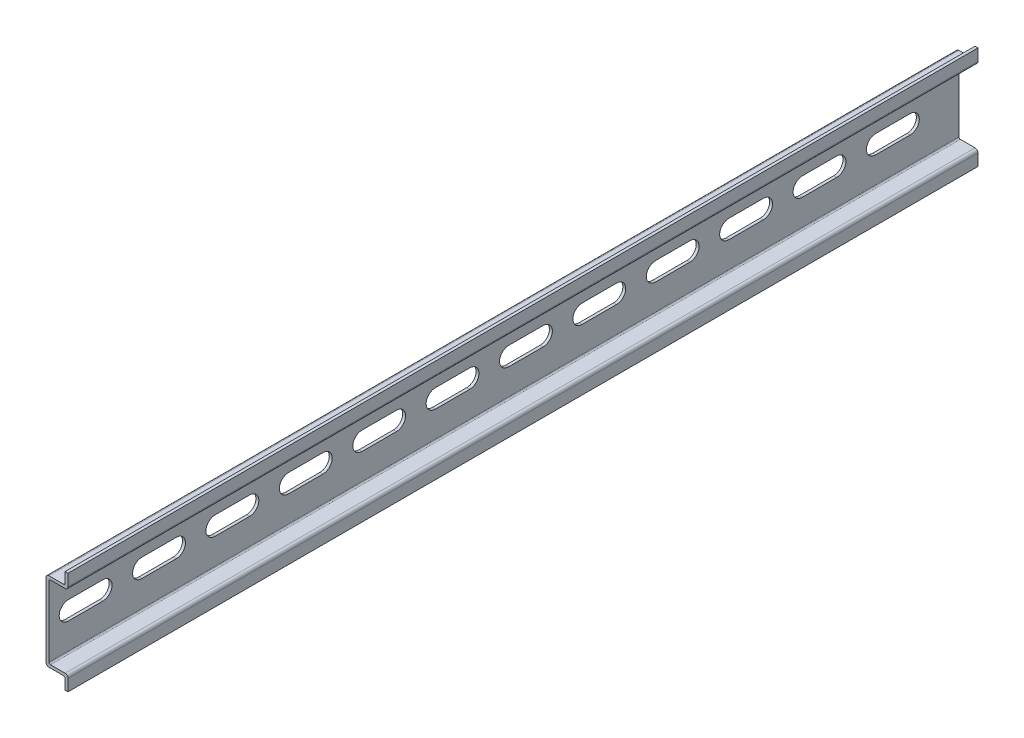
from build123d import *

# Parameters (mm, degrees)
BOSS_EXTRUDE1_DEPTH = 155
CUT_EXTRUDE1_DEPTH  = 7.5
LPATTERN1_COUNT     = 12
LPATTERN1_PITCH     = 25


with BuildPart() as part:
    # Sketch1 → Boss-Extrude1 (new, symmetric)
    with BuildSketch(Plane.XY):
        with BuildLine():
            Line((7.5, 17.5), (6.5, 17.5))
            Line((6.5, 17.5), (6.5, 14))
            ThreePointArc((6.5, 14), (6.353553391, 13.646446609), (6, 13.5))
            Line((6, 13.5), (1, 13.5))
            ThreePointArc((1, 13.5), (0.292893219, 13.207106781), (0, 12.5))
            Line((0, 12.5), (0, -12.5))
            ThreePointArc((0, -12.5), (0.292893219, -13.207106781), (1, -13.5))
            Line((1, -13.5), (6, -13.5))
            ThreePointArc((6, -13.5), (6.353553391, -13.646446609), (6.5, -14))
            Line((6.5, -14), (6.5, -17.5))
            Line((6.5, -17.5), (7.5, -17.5))
            Line((7.5, -17.5), (7.5, -13.5))
            ThreePointArc((7.5, -13.5), (7.207106781, -12.792893219), (6.5, -12.5))
            Line((6.5, -12.5), (1.5, -12.5))
            ThreePointArc((1.5, -12.5), (1.146446609, -12.353553391), (1, -12))
            Line((1, -12), (1, 12))
            ThreePointArc((1, 12), (1.146446609, 12.353553391), (1.5, 12.5))
            Line((1.5, 12.5), (6.5, 12.5))
            ThreePointArc((6.5, 12.5), (7.207106781, 12.792893219), (7.5, 13.5))
            Line((7.5, 13.5), (7.5, 17.5))
        make_face()
    extrude(amount=BOSS_EXTRUDE1_DEPTH, both=True)

    # Sketch2 → Cut-Extrude1 (cut)
    with BuildSketch(Plane(origin=(0, 0, 0), x_dir=(0, 0, -1), z_dir=(1, 0, 0))):
        with BuildLine():
            Line((-148.35, 3.15), (-136.65, 3.15))
            ThreePointArc((-136.65, 3.15), (-133.5, 0), (-136.65, -3.15))
            Line((-136.65, -3.15), (-148.35, -3.15))
            ThreePointArc((-148.35, -3.15), (-151.5, 0), (-148.35, 3.15))
        make_face()
    cut_extrude1 = extrude(amount=CUT_EXTRUDE1_DEPTH, mode=Mode.SUBTRACT)

    # LPattern1: Cut-Extrude1 ×12
    with Locations(*[(0, 0, -i * LPATTERN1_PITCH) for i in range(1, LPATTERN1_COUNT)]):
        add(cut_extrude1, mode=Mode.SUBTRACT)


solid = part.part
